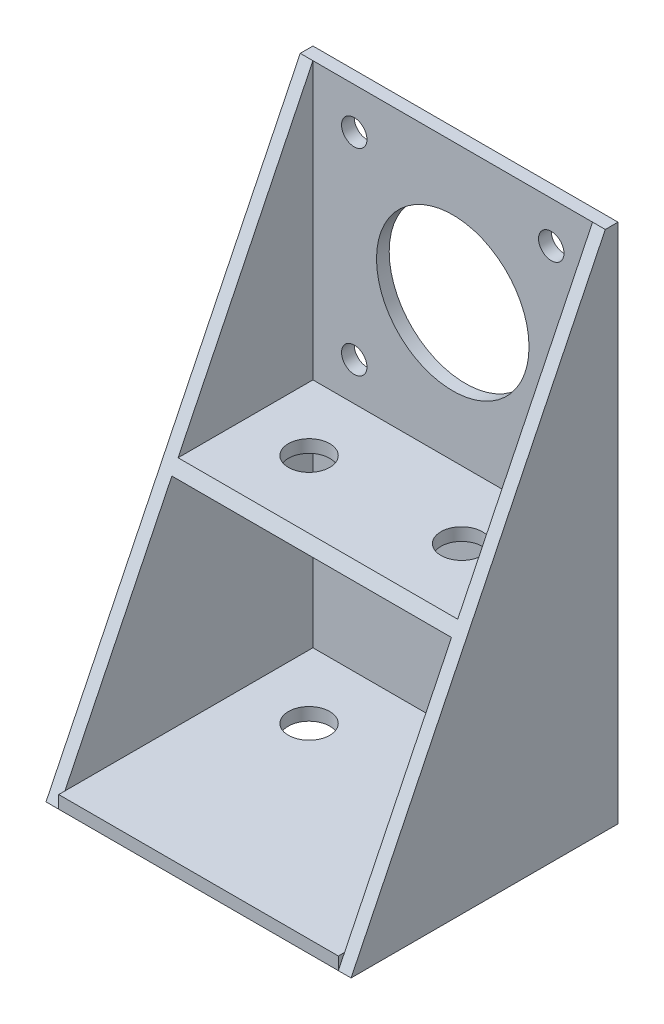
from build123d import *

# Parameters (mm, degrees)
CROQUIS1_W              = 44
CROQUIS1_H              = 44
SALIENTE_EXTRUIR1_DEPTH = 2
CROQUIS2_R              = 12
CROQUIS2_R_2            = 2
CORTAR_EXTRUIR1_DEPTH   = 2
CROQUIS3_W              = 44
CROQUIS3_H              = 38
SALIENTE_EXTRUIR2_DEPTH = 2
CROQUIS4_W              = 44
CROQUIS4_H              = 2
SALIENTE_EXTRUIR3_DEPTH = 29
SALIENTE_EXTRUIR4_DEPTH = 2
SALIENTE_EXTRUIR5_DEPTH = 2
CORTAR_EXTRUIR2_DEPTH   = 44
CROQUIS10_W             = 44
CROQUIS10_H             = 40
SALIENTE_EXTRUIR6_DEPTH = 2
CROQUIS11_R             = 3.25
CORTAR_EXTRUIR3_DEPTH   = 66.055745327


with BuildPart() as part:
    # Croquis1 → Saliente-Extruir1 (new body)
    with BuildSketch(Plane.XY):
        Rectangle(CROQUIS1_W, CROQUIS1_H)
    extrude(amount=SALIENTE_EXTRUIR1_DEPTH)

    # Croquis2 → Cortar-Extruir1 (cut)
    with BuildSketch(Plane.XY.offset(2)):
        Circle(CROQUIS2_R)
        with Locations((-15.5, 15.5)):
            Circle(CROQUIS2_R_2)
        with Locations((15.5, 15.5)):
            Circle(CROQUIS2_R_2)
        with Locations((15.5, -15.5)):
            Circle(CROQUIS2_R_2)
        with Locations((-15.5, -15.5)):
            Circle(CROQUIS2_R_2)
    extrude(amount=-CORTAR_EXTRUIR1_DEPTH, mode=Mode.SUBTRACT)

    # Croquis3 → Saliente-Extruir2 (add)
    with BuildSketch(Plane.XY.offset(2)):
        with Locations((0, -41)):
            Rectangle(CROQUIS3_W, CROQUIS3_H)
    extrude(amount=-SALIENTE_EXTRUIR2_DEPTH)

    # Croquis4 → Saliente-Extruir3 (add)
    with BuildSketch(Plane.XY.offset(2)):
        with Locations((0, -22.5)):
            Rectangle(CROQUIS4_W, CROQUIS4_H)
    extrude(amount=SALIENTE_EXTRUIR3_DEPTH)

    # Croquis5 → Saliente-Extruir4 (add)
    with BuildSketch(Plane.ZY.offset(22)):
        Polygon((2, 22), (42, -60), (2, -60), (0, -60), (0, 22), align=None)
    extrude(amount=SALIENTE_EXTRUIR4_DEPTH)

    # Croquis7 → Saliente-Extruir5 (add)
    with BuildSketch(Plane(origin=(22, 0, 0), x_dir=(0, 0, -1), z_dir=(1, 0, 0))):
        Polygon((0, -60), (-42, -60), (-2, 22), (0, 22), align=None)
    extrude(amount=SALIENTE_EXTRUIR5_DEPTH)

    # Croquis8 → Cortar-Extruir2 (cut)
    with BuildSketch(Plane(origin=(22, 0, 0), x_dir=(0, 0, -1), z_dir=(1, 0, 0))):
        Polygon((-24.195121951, -23.5), (-23.219512195, -21.5), (-31, -21.5), (-31, -23.5), align=None)
    extrude(amount=-CORTAR_EXTRUIR2_DEPTH, mode=Mode.SUBTRACT)

    # Croquis10 → Saliente-Extruir6 (add)
    with BuildSketch(Plane.XZ.offset(60)):
        with Locations((0, 22)):
            Rectangle(CROQUIS10_W, CROQUIS10_H)
    extrude(amount=-SALIENTE_EXTRUIR6_DEPTH)

    # Croquis11 → Cortar-Extruir3 (cut, through all)
    with BuildSketch(Plane(origin=(0, -21.5, 0), x_dir=(1, 0, 0), z_dir=(0, 1, 0))):
        with Locations(Location((-12, -12.609756098, 0), (0, 0, 270))):
            Circle(CROQUIS11_R)
        with Locations(Location((12, -12.609756098, 0), (0, 0, 270))):
            Circle(CROQUIS11_R)
    extrude(amount=-CORTAR_EXTRUIR3_DEPTH, mode=Mode.SUBTRACT)


solid = part.part
